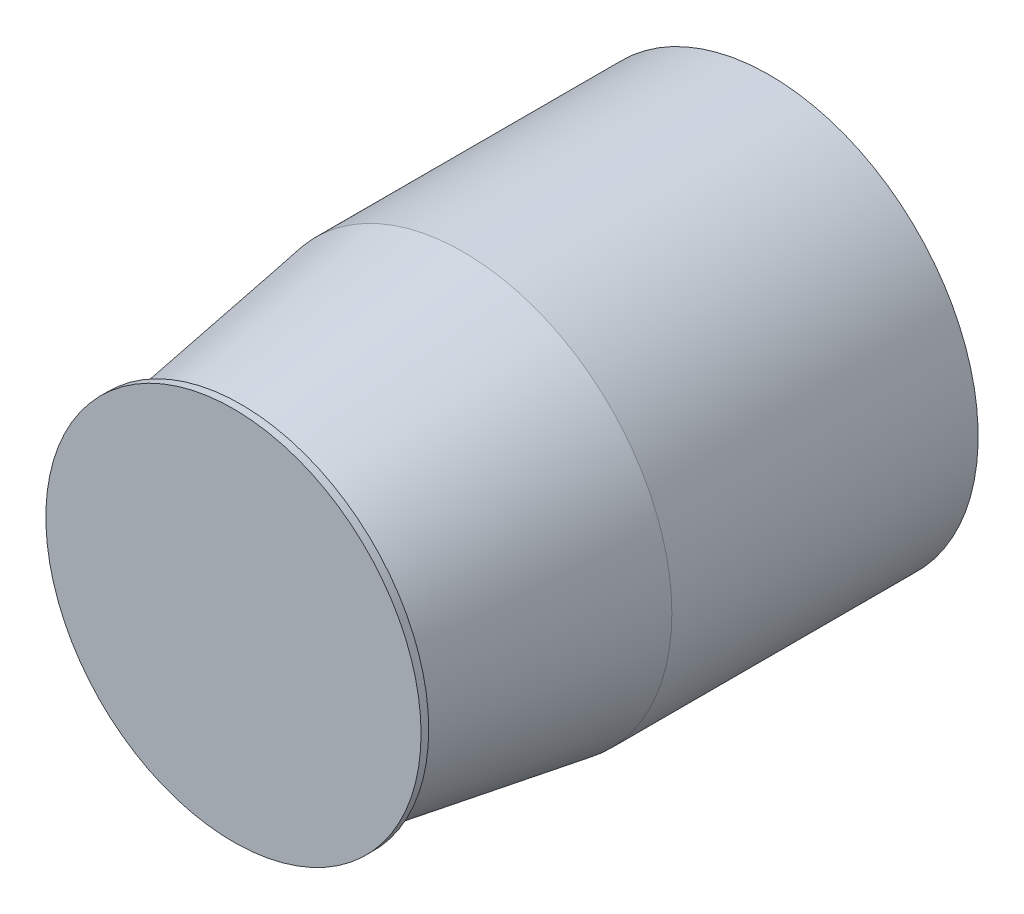
from build123d import *

# Parameters (mm, degrees)
SKETCH1_R           = 11.25
BOSS_EXTRUDE1_DEPTH = 15
BOSS_EXTRUDE1_DRAFT = 9
SKETCH1_3_R         = 12.25
BOSS_EXTRUDE2_DEPTH = 0.5
SKETCH2_R           = 13.625766605
BOSS_EXTRUDE3_DEPTH = 20


with BuildPart() as part:
    # Sketch1 → Boss-Extrude1 (with draft: the straight prism first)
    with BuildSketch(Plane.XY):
        Circle(SKETCH1_R)
    extrude(amount=-BOSS_EXTRUDE1_DEPTH)
    # Boss-Extrude1: the draft: its side faces are tilted about the plane it starts from
    boss_extrude1_sides = [part.faces().sort_by_distance(p)[0] for p in [
        (-11.25, 0, -7.5),
    ]]
    draft(boss_extrude1_sides, Plane.XY, BOSS_EXTRUDE1_DRAFT)

    # Sketch1<3> → Boss-Extrude2 (add)
    with BuildSketch(Plane.XY):
        Circle(SKETCH1_3_R)
    extrude(amount=-BOSS_EXTRUDE2_DEPTH)

    # Sketch2 → Boss-Extrude3 (add)
    with BuildSketch(Plane(origin=(0, 0, -15), x_dir=(-1, 0, 0), z_dir=(0, 0, -1))):
        Circle(SKETCH2_R)
    extrude(amount=BOSS_EXTRUDE3_DEPTH)


solid = part.part
